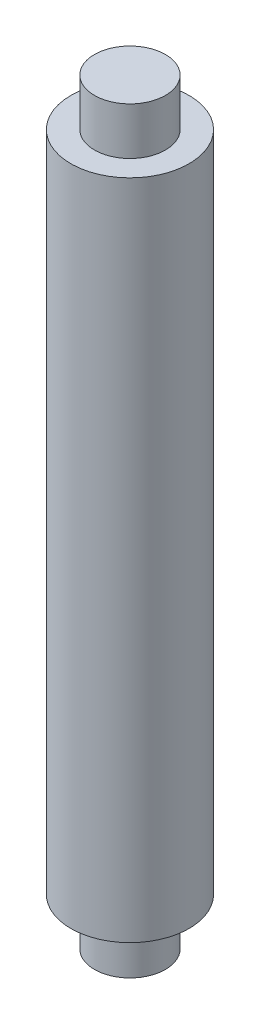
from build123d import *


with BuildPart() as part:
    # Sketch1 → Revolve1 (revolve)
    with BuildSketch(Plane.XY):
        Polygon((0, 10.828947368), (0, -21.171052632), (-1.5, -21.171052632), (-1.5, -19.171052632), (-2.5, -19.171052632), (-2.5, 8.828947368), (-1.5, 8.828947368), (-1.5, 10.828947368), align=None)
    revolve(axis=Axis((0, 10.828947368, 0), (0, -1, 0)))


solid = part.part
